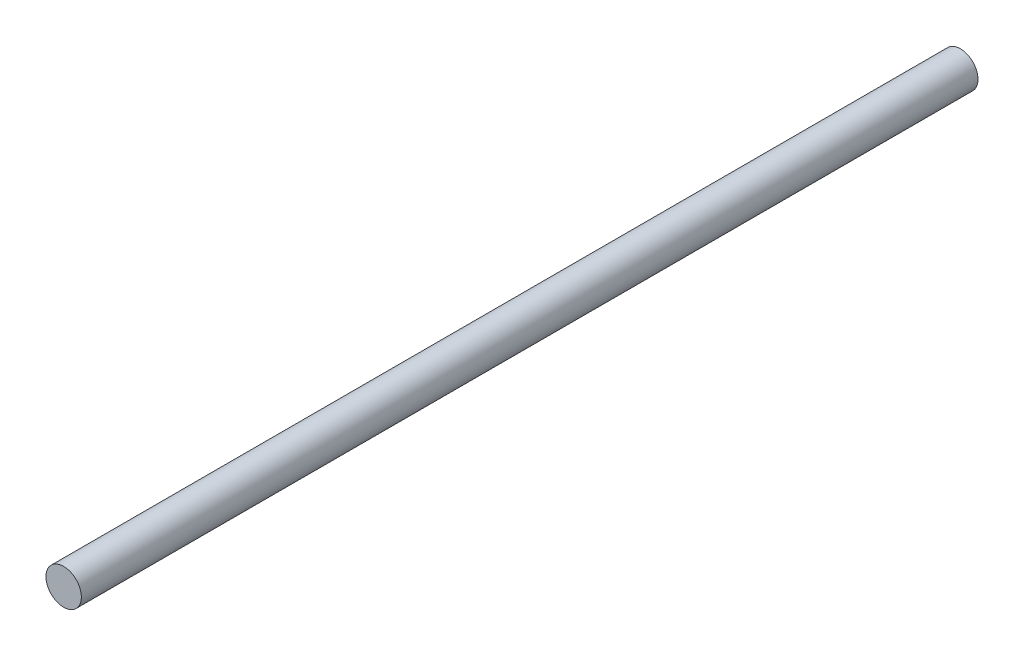
from build123d import *

# Parameters (mm, degrees)
ESBO_O1_R                = 1.5
RESSALTO_EXTRUS_O1_DEPTH = 76


with BuildPart() as part:
    # Esboço1 → Ressalto-extrusão1 (new body)
    with BuildSketch(Plane.XY):
        Circle(ESBO_O1_R)
    extrude(amount=RESSALTO_EXTRUS_O1_DEPTH)


solid = part.part
